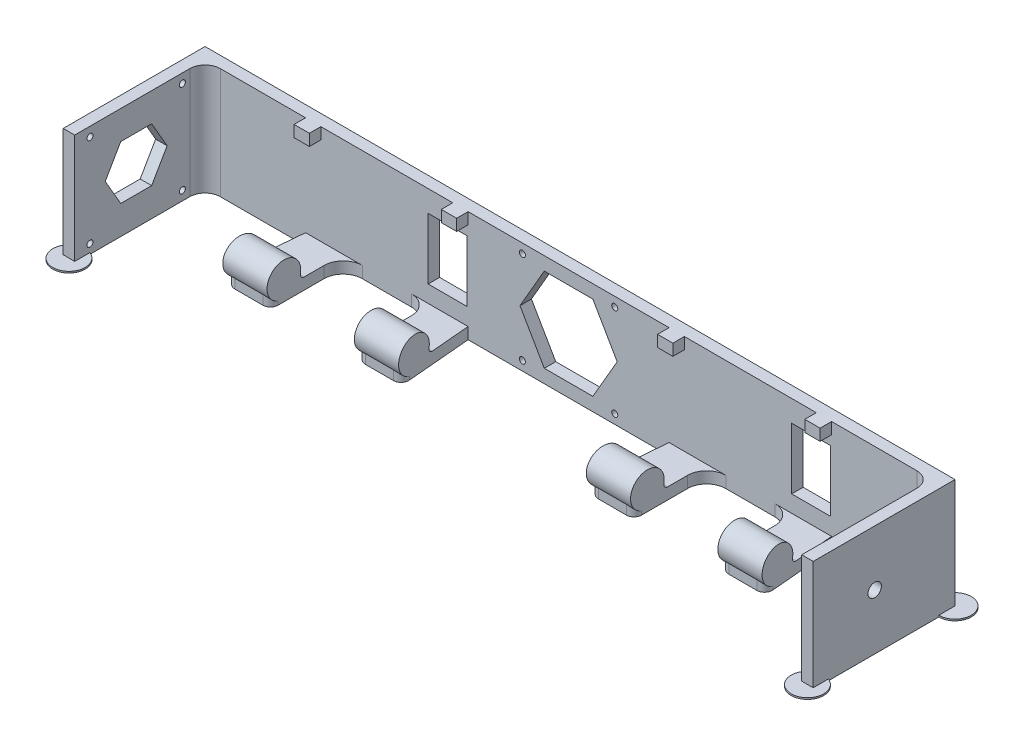
from build123d import *

# Parameters (mm, degrees)
SKETCH1_W           = 190
SKETCH1_H           = 29
BOSS_EXTRUDE1_DEPTH = 3
SKETCH2_W           = 190
SKETCH2_H           = 3
BOSS_EXTRUDE2_DEPTH = 3
SKETCH3_W           = 190
SKETCH3_H           = 3
BOSS_EXTRUDE3_DEPTH = 19
SKETCH4_R           = 4.4
BOSS_EXTRUDE4_DEPTH = 190
FILLET1_R           = 1
SKETCH5_W           = 24.6
SKETCH5_H           = 9.5
SKETCH5_W_2         = 22.8
SKETCH5_W_3         = 49.2
CUT_EXTRUDE1_DEPTH  = 99.13898308
CUT_EXTRUDE3_REACH  = 100.139
SKETCH8_R           = 0.79375
CUT_EXTRUDE4_REACH  = 100.139
SKETCH9_W           = 10.2
SKETCH9_H           = 16
DRAFT1_ANGLE        = -5
FILLET2_R           = 5
FILLET3_R           = 2
SKETCH10_R          = 0.79375
BOSS_EXTRUDE5_DEPTH = 3
BOSS_EXTRUDE8_START = -190
SKETCH10_3_R        = 1.75
BOSS_EXTRUDE8_DEPTH = 3
SKETCH12_W          = 26.262284607
SKETCH12_H          = 3
SKETCH12_W_2        = 34.475430786
SKETCH12_W_3        = 52.524569214
CUT_EXTRUDE5_DEPTH  = 105.761807039
SKETCH13_R          = 4.242640687
BOSS_EXTRUDE9_DEPTH = 0.4
FILLET4_R           = 4


with BuildPart() as part:
    # Sketch1 → Boss-Extrude1 (new body)
    with BuildSketch(Plane.XY):
        Rectangle(SKETCH1_W, SKETCH1_H)
    extrude(amount=BOSS_EXTRUDE1_DEPTH)

    # Sketch2 → Boss-Extrude2 (add)
    with BuildSketch(Plane.XY.offset(3)):
        with Locations((0, 13)):
            Rectangle(SKETCH2_W, SKETCH2_H)
    extrude(amount=BOSS_EXTRUDE2_DEPTH)

    # Sketch3 → Boss-Extrude3 (add)
    with BuildSketch(Plane.XY.offset(3)):
        with Locations((0, -13)):
            Rectangle(SKETCH3_W, SKETCH3_H)
    extrude(amount=BOSS_EXTRUDE3_DEPTH)

    # Sketch4 → Boss-Extrude4 (add)
    with BuildSketch(Plane.ZY.offset(95)):
        with Locations((18.5, -9.4)):
            Circle(SKETCH4_R)
    extrude(amount=-BOSS_EXTRUDE4_DEPTH)

    # Fillet1
    fillet1_edges = [part.edges().sort_by_distance(p)[0] for p in [
        (0, -11.5, 14.633477014),
    ]]
    fillet(fillet1_edges, radius=FILLET1_R)

    # Sketch5 → Cut-Extrude1 (cut, through all)
    with BuildSketch(Plane.XY.offset(3)):
        with Locations((-82.7, -9.75)):
            Rectangle(SKETCH5_W, SKETCH5_H)
        with Locations((-47.5, -9.75)):
            Rectangle(SKETCH5_W_2, SKETCH5_H)
        with Locations((0, -9.75)):
            Rectangle(SKETCH5_W_3, SKETCH5_H)
        with Locations((47.5, -9.75)):
            Rectangle(SKETCH5_W_2, SKETCH5_H)
        with Locations((82.7, -9.75)):
            Rectangle(SKETCH5_W, SKETCH5_H)
    extrude(amount=CUT_EXTRUDE1_DEPTH, mode=Mode.SUBTRACT)

    # Sketch8 → Cut-Extrude3 (cut, up to next)
    with BuildSketch(Plane.XY.offset(3), mode=Mode.PRIVATE) as cut_extrude3_sk1:
        with Locations((-12.066777221, -12.066777221)):
            Circle(SKETCH8_R)
    cut_extrude3_tool1 = extrude(cut_extrude3_sk1.sketch, amount=-CUT_EXTRUDE3_REACH, mode=Mode.PRIVATE) & part.part
    # Sketch8 → Cut-Extrude3 (cut, up to next)
    with BuildSketch(Plane.XY.offset(3), mode=Mode.PRIVATE) as cut_extrude3_sk2:
        with Locations((-12.066777221, 12.066777221)):
            Circle(SKETCH8_R)
    cut_extrude3_tool2 = extrude(cut_extrude3_sk2.sketch, amount=-CUT_EXTRUDE3_REACH, mode=Mode.PRIVATE) & part.part
    # Sketch8 → Cut-Extrude3 (cut, up to next)
    with BuildSketch(Plane.XY.offset(3), mode=Mode.PRIVATE) as cut_extrude3_sk3:
        with Locations((12.066777221, 12.066777221)):
            Circle(SKETCH8_R)
    cut_extrude3_tool3 = extrude(cut_extrude3_sk3.sketch, amount=-CUT_EXTRUDE3_REACH, mode=Mode.PRIVATE) & part.part
    # Sketch8 → Cut-Extrude3 (cut, up to next)
    with BuildSketch(Plane.XY.offset(3), mode=Mode.PRIVATE) as cut_extrude3_sk4:
        with Locations((12.066777221, -12.066777221)):
            Circle(SKETCH8_R)
    cut_extrude3_tool4 = extrude(cut_extrude3_sk4.sketch, amount=-CUT_EXTRUDE3_REACH, mode=Mode.PRIVATE) & part.part
    # Sketch8 → Cut-Extrude3 (cut, up to next)
    with BuildSketch(Plane.XY.offset(3), mode=Mode.PRIVATE) as cut_extrude3_sk5:
        Polygon((6.350852961, -11), (12.701705922, 0), (6.350852961, 11), (-6.350852961, 11), (-12.701705922, 0), (-6.350852961, -11), align=None)
    cut_extrude3_tool5 = extrude(cut_extrude3_sk5.sketch, amount=-CUT_EXTRUDE3_REACH, mode=Mode.PRIVATE) & part.part
    add(cut_extrude3_tool1.solids().sort_by_distance((-12.066777, -12.066777, 3))[0], mode=Mode.SUBTRACT)
    add(cut_extrude3_tool2.solids().sort_by_distance((-12.066777, 12.066777, 3))[0], mode=Mode.SUBTRACT)
    add(cut_extrude3_tool3.solids().sort_by_distance((12.066777, 12.066777, 3))[0], mode=Mode.SUBTRACT)
    add(cut_extrude3_tool4.solids().sort_by_distance((12.066777, -12.066777, 3))[0], mode=Mode.SUBTRACT)
    add(cut_extrude3_tool5.solids().sort_by_distance((0, 0, 3))[0], mode=Mode.SUBTRACT)

    # Sketch9 → Cut-Extrude4 (cut, up to next)
    with BuildSketch(Plane.XY.offset(3), mode=Mode.PRIVATE) as cut_extrude4_sk1:
        with Locations((-31.6, 0.9)):
            Rectangle(SKETCH9_W, SKETCH9_H)
    cut_extrude4_tool1 = extrude(cut_extrude4_sk1.sketch, amount=-CUT_EXTRUDE4_REACH, mode=Mode.PRIVATE) & part.part
    # Sketch9 → Cut-Extrude4 (cut, up to next)
    with BuildSketch(Plane.XY.offset(3), mode=Mode.PRIVATE) as cut_extrude4_sk2:
        with Locations((63.4, 0.9)):
            Rectangle(SKETCH9_W, SKETCH9_H)
    cut_extrude4_tool2 = extrude(cut_extrude4_sk2.sketch, amount=-CUT_EXTRUDE4_REACH, mode=Mode.PRIVATE) & part.part
    add(cut_extrude4_tool1.solids().sort_by_distance((-31.6, 0.9, 3))[0], mode=Mode.SUBTRACT)
    add(cut_extrude4_tool2.solids().sort_by_distance((63.4, 0.9, 3))[0], mode=Mode.SUBTRACT)

    # Draft1
    draft1_faces = [part.faces().sort_by_distance(p)[0] for p in [
        (70.4, -10.986471989, 15.250758182),
        (24.6, -10.986471989, 15.250758182),
        (-24.6, -10.986471989, 15.250758182),
        (-70.4, -10.986471989, 15.250758182),
    ]]
    draft(draft1_faces, Plane.XY.offset(22), DRAFT1_ANGLE)

    # Fillet2
    fillet2_edges = [part.edges().sort_by_distance(p)[0] for p in [
        (-58.9, -13, 3),
        (-36.1, -13, 3),
        (58.9, -13, 3),
        (36.1, -13, 3),
    ]]
    fillet(fillet2_edges, radius=FILLET2_R)

    # Fillet3
    fillet3_edges = [part.edges().sort_by_distance(p)[0] for p in [
        (-58.9, -13.283229163, 22),
        (-36.1, -13.283229163, 22),
        (-24.6, -13.283229163, 22),
        (24.6, -13.283229163, 22),
        (58.9, -13.283229163, 22),
        (36.1, -13.283229163, 22),
        (70.4, -13.283229163, 22),
        (-70.4, -13.283229163, 22),
    ]]
    fillet(fillet3_edges, radius=FILLET3_R)

    # Sketch10 → Boss-Extrude5 (add)
    # profile 1 of 2: a face of its own
    with BuildSketch(Plane.ZY.offset(95)):
        Polygon((8.929687245, 14.5), (6, 14.5), (6, 11.5), (3, 11.5), (3, -14.5), (37.070312755, -14.5), (37.070312755, 14.5), align=None)
        with Locations((8.929687245, -12.070312755)):
            Circle(SKETCH10_R, mode=Mode.SUBTRACT)
        with Locations((33.070312755, -12.070312755)):
            Circle(SKETCH10_R, mode=Mode.SUBTRACT)
        with Locations((8.929687245, 12.070312755)):
            Circle(SKETCH10_R, mode=Mode.SUBTRACT)
        Polygon((25.041451884, 7), (29.082903769, 0), (25.041451884, -7), (16.958548116, -7), (12.917096231, 0), (16.958548116, 7), align=None, mode=Mode.SUBTRACT)
        with Locations((33.070312755, 12.070312755)):
            Circle(SKETCH10_R, mode=Mode.SUBTRACT)
    # profile 2 of 2: a face of its own
    with BuildSketch(Plane.ZY.offset(95)):
        Polygon((0, 14.5), (0, -14.5), (3, -14.5), (3, 11.5), (6, 11.5), (6, 14.5), align=None)
    extrude(amount=BOSS_EXTRUDE5_DEPTH)

    # Sketch10<3> → Boss-Extrude8 (add)
    with BuildSketch(Plane.ZY.offset(95).offset(BOSS_EXTRUDE8_START)):
        Polygon((0, 14.5), (8.929687245, 14.5), (37.070312755, 14.5), (37.070312755, -14.5), (0, -14.5), align=None)
        with Locations((21, 0)):
            Circle(SKETCH10_3_R, mode=Mode.SUBTRACT)
    extrude(amount=-BOSS_EXTRUDE8_DEPTH)

    # Sketch12 → Cut-Extrude5 (cut, through all)
    with BuildSketch(Plane.XY.offset(3)):
        with Locations((-81.868857697, 13)):
            Rectangle(SKETCH12_W, SKETCH12_H)
        with Locations((-47.5, 13)):
            Rectangle(SKETCH12_W_2, SKETCH12_H)
        with Locations((0, 13)):
            Rectangle(SKETCH12_W_3, SKETCH12_H)
        with Locations((47.5, 13)):
            Rectangle(SKETCH12_W_2, SKETCH12_H)
        with Locations((81.868857697, 13)):
            Rectangle(SKETCH12_W, SKETCH12_H)
    extrude(amount=CUT_EXTRUDE5_DEPTH, mode=Mode.SUBTRACT)

    # Sketch13 → Boss-Extrude9 (add)
    with BuildSketch(Plane.XZ.offset(14.5)):
        with Locations((-96.5, 37.070312755)):
            Circle(SKETCH13_R)
        with Locations((96.5, 37.070312755)):
            Circle(SKETCH13_R)
        with Locations((98, 0)):
            Circle(SKETCH13_R)
        with Locations((-98, 0)):
            Circle(SKETCH13_R)
    extrude(amount=-BOSS_EXTRUDE9_DEPTH)

    # Fillet4
    fillet4_edges = [part.edges().sort_by_distance(p)[0] for p in [
        (95, 0, 3),
        (-95, 0, 3),
    ]]
    fillet(fillet4_edges, radius=FILLET4_R)


solid = part.part
